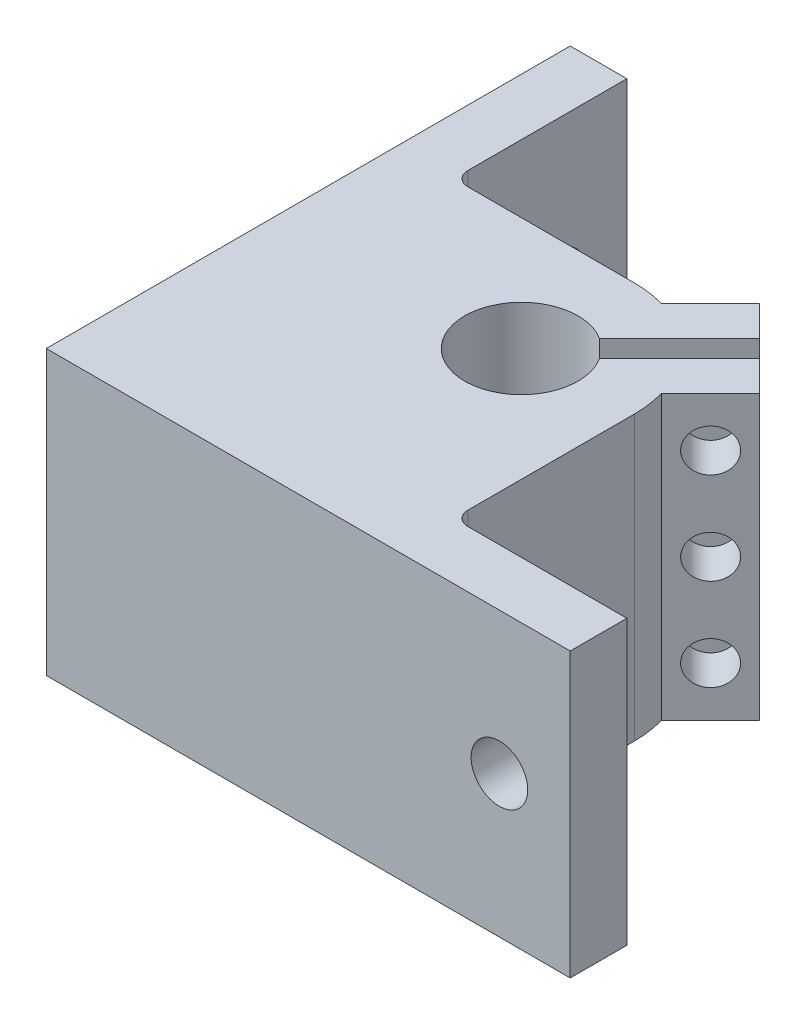
from build123d import *

# Parameters (mm, degrees)
SKETCH1_R               = 4
SKETCH1_W               = 4
SKETCH1_H               = 4
BOSS_EXTRUDE1_DEPTH     = 20
FILLET1_R               = 1
SKETCH2_R               = 2
CUT_EXTRUDE1_DEPTH      = 20
SKETCH3_R               = 2
CUT_EXTRUDE2_DEPTH      = 20
CUT_EXTRUDE4_REACH      = 58.018
BOSS_EXTRUDE4_DEPTH     = 20
CUT_EXTRUDE5_DEPTH      = 57.151719698
CUT_EXTRUDE5_DEPTH_BACK = 57.151719698
SKETCH9_R               = 1.5


with BuildPart() as part:
    # Sketch1 → Boss-Extrude1 (new body)
    # profile 1 of 5: a face of its own
    with BuildSketch(Plane(origin=(0, 0, 0), x_dir=(1, 0, 0), z_dir=(0, 1, 0))):
        with BuildLine():
            ThreePointArc((24.775, 16.775), (11.118145751, 11.118145751), (16.775, 24.775))
            Line((16.775, 24.775), (4, 24.775))
            Line((4, 24.775), (4, 4))
            Line((4, 4), (24.775, 4))
            Line((24.775, 4), (24.775, 16.775))
        make_face()
    # profile 2 of 5: a face of its own
    with BuildSketch(Plane(origin=(0, 0, 0), x_dir=(1, 0, 0), z_dir=(0, 1, 0))):
        with BuildLine():
            ThreePointArc((24.775, 16.775), (22.431854249, 22.431854249), (16.775, 24.775))
            ThreePointArc((16.775, 24.775), (11.118145751, 11.118145751), (24.775, 16.775))
        make_face()
        with Locations(Location((16.775, 16.775, 0), (0, 0, 270))):
            Circle(SKETCH1_R, mode=Mode.SUBTRACT)
    # profile 3 of 5: a face of its own
    with BuildSketch(Plane(origin=(0, 0, 0), x_dir=(1, 0, 0), z_dir=(0, 1, 0))):
        Polygon((4, 4), (4, 24.775), (4, 37), (0, 37), (0, 4), align=None)
    # profile 4 of 5: a face of its own
    with BuildSketch(Plane(origin=(0, 0, 0), x_dir=(1, 0, 0), z_dir=(0, 1, 0))):
        Polygon((24.775, 4), (4, 4), (4, 0), (37, 0), (37, 4), align=None)
    # profile 5 of 5: a face of its own
    with BuildSketch(Plane(origin=(0, 0, 0), x_dir=(1, 0, 0), z_dir=(0, 1, 0))):
        with Locations((2, 2)):
            Rectangle(SKETCH1_W, SKETCH1_H)
    extrude(amount=BOSS_EXTRUDE1_DEPTH)

    # Fillet1
    fillet1_edges = [part.edges().sort_by_distance(p)[0] for p in [
        (24.775, 10, -4),
        (4, 10, -24.775),
    ]]
    fillet(fillet1_edges, radius=FILLET1_R)

    # Sketch2 → Cut-Extrude1 (cut)
    with BuildSketch(Plane(origin=(0, 0, -4), x_dir=(-1, 0, 0), z_dir=(0, 0, -1))):
        with Locations((-32, 10)):
            Circle(SKETCH2_R)
    extrude(amount=-CUT_EXTRUDE1_DEPTH, mode=Mode.SUBTRACT)

    # Sketch3 → Cut-Extrude2 (cut)
    with BuildSketch(Plane(origin=(4, 0, 0), x_dir=(0, 0, -1), z_dir=(1, 0, 0))):
        with Locations((32, 10)):
            Circle(SKETCH3_R)
    extrude(amount=-CUT_EXTRUDE2_DEPTH, mode=Mode.SUBTRACT)

    # Sketch7 → Cut-Extrude4 (cut, up to next)
    with BuildSketch(Plane(origin=(0, 20, 0), x_dir=(1, 0, 0), z_dir=(0, 1, 0)), mode=Mode.PRIVATE) as cut_extrude4_sk1:
        Polygon((20.153643704, 18.916206837), (18.916206837, 20.153643704), (23.158847524, 24.396284391), (24.396284391, 23.158847524), align=None)
    cut_extrude4_tool1 = extrude(cut_extrude4_sk1.sketch, amount=-CUT_EXTRUDE4_REACH, mode=Mode.PRIVATE) & part.part
    add(cut_extrude4_tool1.solids().sort_by_distance((21.656246, 20, -21.656246))[0], mode=Mode.SUBTRACT)

    # Sketch8 → Boss-Extrude4 (add)
    with BuildSketch(Plane(origin=(0, 20, 0), x_dir=(1, 0, 0), z_dir=(0, 1, 0))):
        Polygon((18.916206837, 20.153643704), (24.573061087, 25.810497954), (22.451740743, 27.931818297), (16.794886494, 22.274964048), align=None)
        Polygon((22.274964048, 16.794886494), (20.153643704, 18.916206837), (25.810497954, 24.573061087), (27.931818297, 22.451740743), align=None)
    extrude(amount=-BOSS_EXTRUDE4_DEPTH)

    # Sketch9 → Cut-Extrude5 (cut, two sides: drawn at the far end of the back side and taken through both)
    with BuildSketch(Plane(origin=(2.740038777, 0, 2.740038777), x_dir=(0.7071067811865474, 0, -0.7071067811865477), z_dir=(0.7071067811865477, 0, 0.7071067811865474)).offset(-CUT_EXTRUDE5_DEPTH_BACK)):
        with Locations((33.174436303, 16.5)):
            Circle(SKETCH9_R)
        with Locations((33.174436303, 10)):
            Circle(SKETCH9_R)
        with Locations((33.174436303, 3.5)):
            Circle(SKETCH9_R)
    extrude(amount=CUT_EXTRUDE5_DEPTH + CUT_EXTRUDE5_DEPTH_BACK, mode=Mode.SUBTRACT)


solid = part.part
